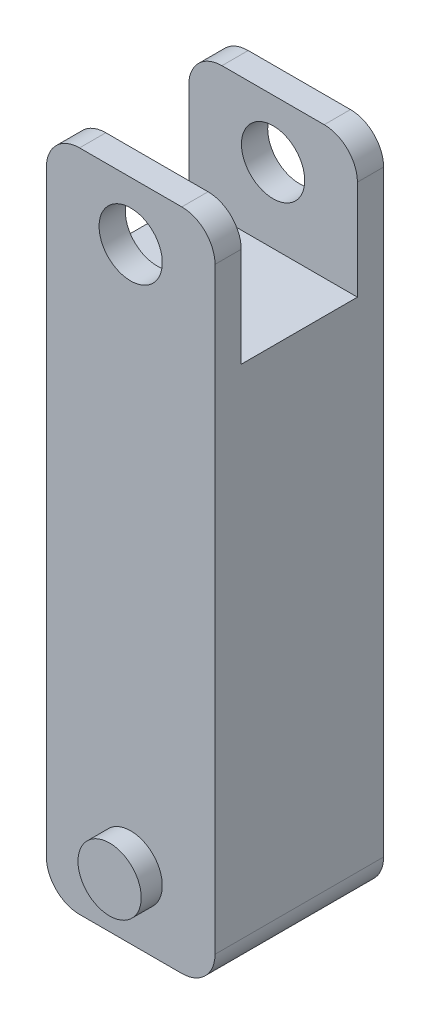
from build123d import *

# Parameters (mm, degrees)
CROQUIS1_W              = 101.6
CROQUIS1_H              = 101.6
SALIENTE_EXTRUIR1_DEPTH = 400
CROQUIS2_R              = 19.05
SALIENTE_EXTRUIR2_DEPTH = 12.7
SALIENTE_EXTRUIR3_START = 12.7
CROQUIS3_R              = 19.05
SALIENTE_EXTRUIR3_DEPTH = 12.7
REDONDEO1_R             = 20
CROQUIS5_W              = 70
CROQUIS5_H              = 80
CORTAR_EXTRUIR1_DEPTH   = 101.6
CORTAR_EXTRUIR2_REACH   = 421.1
CROQUIS6_R              = 19.05
REDONDEO2_R             = 20


with BuildPart() as part:
    # Croquis1 → Saliente-Extruir1 (new body)
    with BuildSketch(Plane(origin=(0, 0, 0), x_dir=(1, 0, 0), z_dir=(0, 1, 0))):
        Rectangle(CROQUIS1_W, CROQUIS1_H)
    extrude(amount=SALIENTE_EXTRUIR1_DEPTH)

    # Croquis2 → Saliente-Extruir2 (add)
    with BuildSketch(Plane.XY.offset(50.8)):
        with Locations(Location((0, 40, 0), (0, 0, 180))):
            Circle(CROQUIS2_R)
    extrude(amount=SALIENTE_EXTRUIR2_DEPTH)

    # Croquis3 → Saliente-Extruir3 (add)
    with BuildSketch(Plane(origin=(0, 0, -50.8), x_dir=(-1, 0, 0), z_dir=(0, 0, -1)).offset(SALIENTE_EXTRUIR3_START)):
        with Locations((0, 40)):
            Circle(CROQUIS3_R)
    extrude(amount=-SALIENTE_EXTRUIR3_DEPTH)

    # Redondeo1
    redondeo1_edges = [part.edges().sort_by_distance(p)[0] for p in [
        (-50.8, 0, 0),
        (50.8, 0, 0),
    ]]
    fillet(redondeo1_edges, radius=REDONDEO1_R)

    # Croquis5 → Cortar-Extruir1 (cut)
    with BuildSketch(Plane(origin=(50.8, 0, 0), x_dir=(0, 0, -1), z_dir=(1, 0, 0))):
        with Locations((0, 360)):
            Rectangle(CROQUIS5_W, CROQUIS5_H)
    extrude(amount=-CORTAR_EXTRUIR1_DEPTH, mode=Mode.SUBTRACT)

    # Cortar-Extruir2: up to this face of the body (flat: up to its plane)
    cortar_extruir2_end = Plane(part.part.faces().sort_by_distance((0, 205.491832247, 50.8))[0])
    # Croquis6 → Cortar-Extruir2 (cut, up to the picked face)
    with BuildSketch(Plane(origin=(0, 0, -50.8), x_dir=(-1, 0, 0), z_dir=(0, 0, -1)), mode=Mode.PRIVATE) as cortar_extruir2_sk1:
        with Locations((0, 365)):
            Circle(CROQUIS6_R)
    cortar_extruir2_tool1 = split(extrude(cortar_extruir2_sk1.sketch, amount=-CORTAR_EXTRUIR2_REACH, mode=Mode.PRIVATE), bisect_by=cortar_extruir2_end, keep=Keep.BOTH, mode=Mode.PRIVATE)
    add(cortar_extruir2_tool1.solids().sort_by(Axis((0, 365, -50.8), (0, 0, 1)))[0], mode=Mode.SUBTRACT)

    # Redondeo2
    redondeo2_edges = [part.edges().sort_by_distance(p)[0] for p in [
        (-50.8, 400, -42.9),
        (50.8, 400, -42.9),
        (-50.8, 400, 42.9),
        (50.8, 400, 42.9),
    ]]
    fillet(redondeo2_edges, radius=REDONDEO2_R)


solid = part.part
